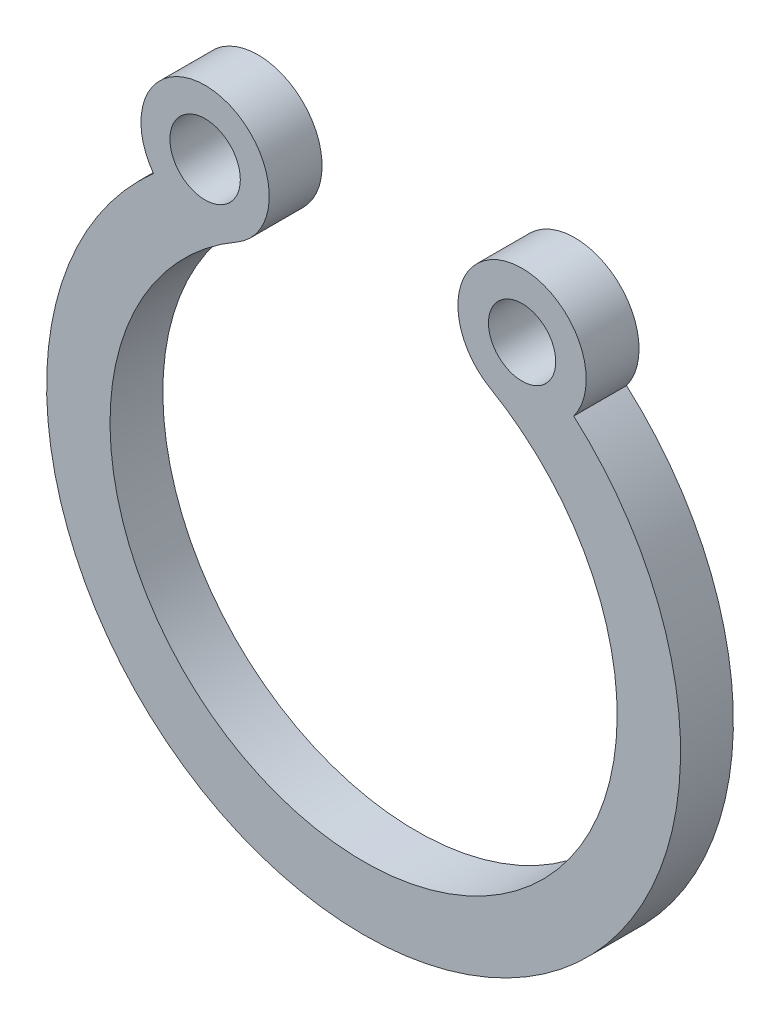
from build123d import *

# Parameters (mm, degrees)
RESSALTO_EXTRUS_O1_DEPTH = 1
ESBO_O2_R                = 0.666692757
ESBO_O2_R_2              = 0.636816377
CORTE_EXTRUS_O1_DEPTH    = 1


with BuildPart() as part:
    # Esboço1 → Ressalto-extrusão1 (new body)
    with BuildSketch(Plane.XY):
        with BuildLine():
            ThreePointArc((-2.394289804, 4.160213496), (0, -4.8), (2.394289804, 4.160213496))
            ThreePointArc((2.394289804, 4.160213496), (2.750795728, 6.401132349), (3.977471151, 4.492184685))
            ThreePointArc((3.977471151, 4.492184685), (0, -6), (-3.977471151, 4.492184685))
            ThreePointArc((-3.977471151, 4.492184685), (-2.750795728, 6.401132349), (-2.394289804, 4.160213496))
        make_face()
    extrude(amount=RESSALTO_EXTRUS_O1_DEPTH)

    # Esboço2 → Corte-extrusão1 (cut)
    with BuildSketch(Plane.XY.offset(1)):
        with Locations((-3, 5.212669105)):
            Circle(ESBO_O2_R)
        with Locations((3, 5.212669105)):
            Circle(ESBO_O2_R_2)
    extrude(amount=-CORTE_EXTRUS_O1_DEPTH, mode=Mode.SUBTRACT)


solid = part.part
